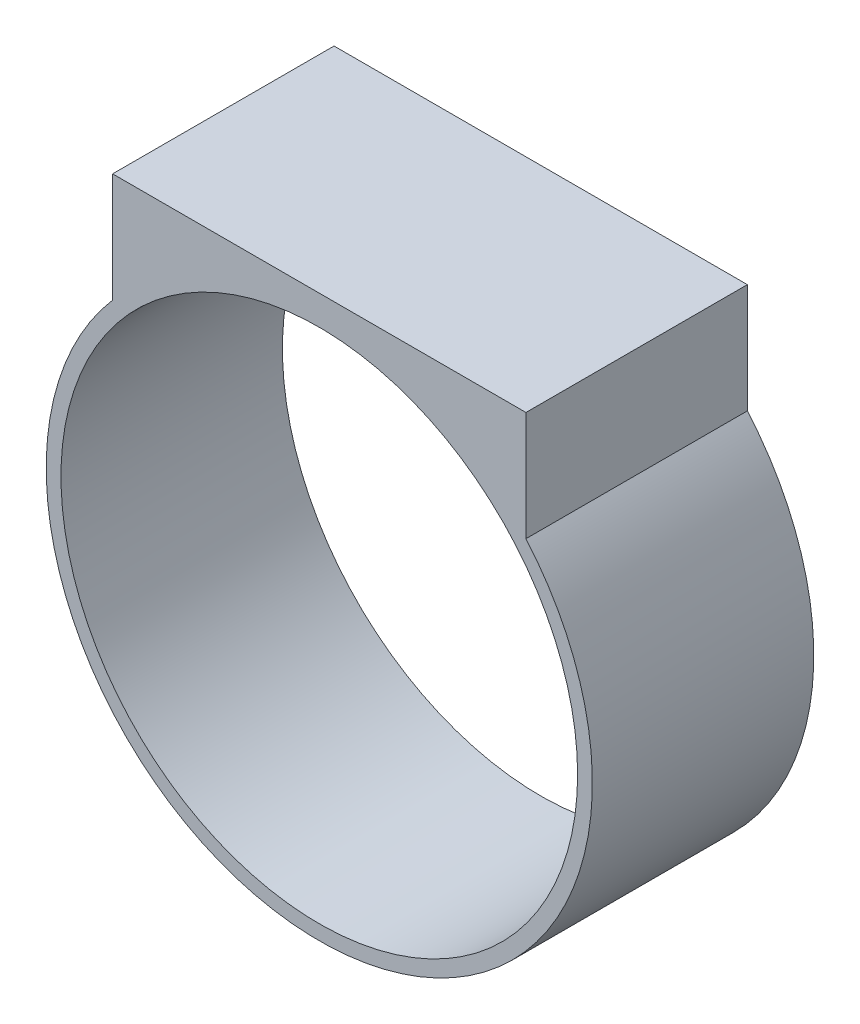
from build123d import *

# Parameters (mm, degrees)
SKETCH3_R                       = 92.5
SKETCH3_R_2                     = 87.5
BOSS_EXTRUDE3_DEPTH             = 75
BOSS_EXTRUDE4_REACH             = 222.014
BOSS_EXTRUDE4_END_RADIUS        = 92.5
SKETCH4_W                       = 140
SKETCH4_H                       = 75
BOSS_EXTRUDE4_DIRECTION_2_DEPTH = 5


with BuildPart() as part:
    # Sketch3 → Boss-Extrude3 (new body)
    with BuildSketch(Plane.XY):
        Circle(SKETCH3_R)
        Circle(SKETCH3_R_2, mode=Mode.SUBTRACT)
    extrude(amount=BOSS_EXTRUDE3_DEPTH)

    # Boss-Extrude4: up to this cylinder (the profile starts outside it)
    boss_extrude4_end = Plane(origin=(0, 0, 37.5), z_dir=(0, 0, -1)) * Cylinder(BOSS_EXTRUDE4_END_RADIUS, 630.028, mode=Mode.PRIVATE)
    # Sketch4 → Boss-Extrude4 (add, up to the surface)
    with BuildSketch(Plane(origin=(0, 92.5, 0), x_dir=(1, 0, 0), z_dir=(0, 1, 0)), mode=Mode.PRIVATE) as boss_extrude4_sk1:
        with Locations((0, -37.5)):
            Rectangle(SKETCH4_W, SKETCH4_H)
    boss_extrude4_tool1 = extrude(boss_extrude4_sk1.sketch, amount=-BOSS_EXTRUDE4_REACH, mode=Mode.PRIVATE) - boss_extrude4_end
    add(boss_extrude4_tool1.solids().sort_by_distance((0, 92.5, 37.5))[0])
    add(boss_extrude4_tool1.solids().sort_by_distance((0, 92.5, 37.5))[1])

    # Sketch4 → Boss-Extrude4 direction 2 (add)
    with BuildSketch(Plane(origin=(0, 92.5, 0), x_dir=(1, 0, 0), z_dir=(0, 1, 0))):
        with Locations((0, -37.5)):
            Rectangle(SKETCH4_W, SKETCH4_H)
    extrude(amount=BOSS_EXTRUDE4_DIRECTION_2_DEPTH)


solid = part.part
